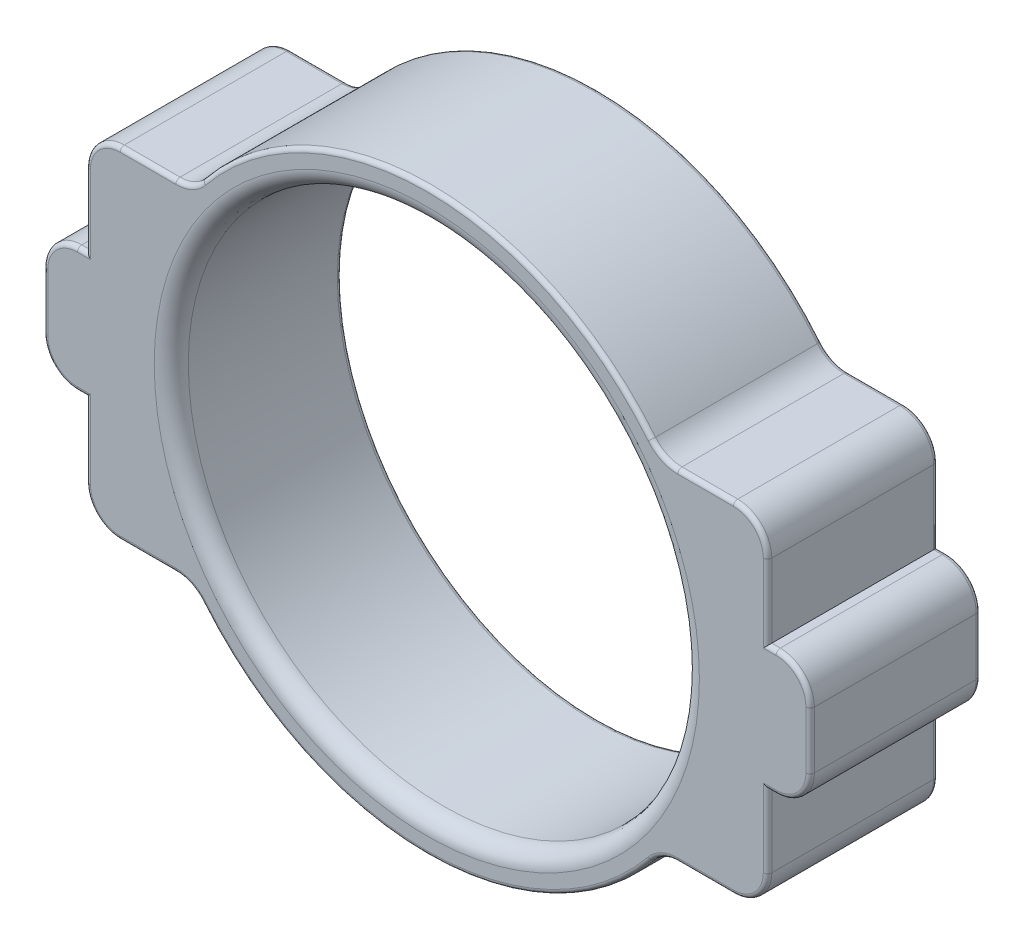
from build123d import *

# Parameters (mm, degrees)
BOSS_EXTRU_2_DEPTH           = 5
BOSS_EXTRU_2_DEPTH_BACK      = 5
ESQUISSE1_R                  = 15
ENL_V_MAT_EXTRU_1_DEPTH      = 4
ENL_V_MAT_EXTRU_1_DEPTH_BACK = 4
CONG_1_R                     = 1
CONG_2_R                     = 0.25
CONG_3_R                     = 0.25
CONG_4_R                     = 0.25


with BuildPart() as part:
    # Esquisse1 → Boss.-Extru.2 (new, two sides: drawn at the far end of the back side and taken through both)
    with BuildSketch(Plane.XY.offset(-BOSS_EXTRU_2_DEPTH_BACK)):
        with BuildLine():
            Line((14.730919863, -10), (18, -10))
            ThreePointArc((18, -10), (19.414213562, -9.414213562), (20, -8))
            Line((20, -8), (20, -3.673898915))
            Line((20, -3.673898915), (20.5, -3.673898915))
            ThreePointArc((20.5, -3.673898915), (21.914213562, -3.088112478), (22.5, -1.673898915))
            Line((22.5, -1.673898915), (22.5, 1.673898915))
            ThreePointArc((22.5, 1.673898915), (21.914213562, 3.088112478), (20.5, 3.673898915))
            Line((20.5, 3.673898915), (20, 3.673898915))
            Line((20, 3.673898915), (20, 8))
            ThreePointArc((20, 8), (19.414213562, 9.414213562), (18, 10))
            Line((18, 10), (14.730919863, 10))
            ThreePointArc((14.730919863, 10), (13.872524787, 10.193578705), (13.180296719, 10.736842105))
            ThreePointArc((13.180296719, 10.736842105), (0, 17), (-13.180296719, 10.736842105))
            ThreePointArc((-13.180296719, 10.736842105), (-13.872524787, 10.193578705), (-14.730919863, 10))
            Line((-14.730919863, 10), (-18, 10))
            ThreePointArc((-18, 10), (-19.414213562, 9.414213562), (-20, 8))
            Line((-20, 8), (-20, 3.673898915))
            Line((-20, 3.673898915), (-20.5, 3.673898915))
            ThreePointArc((-20.5, 3.673898915), (-21.914213562, 3.088112478), (-22.5, 1.673898915))
            Line((-22.5, 1.673898915), (-22.5, -1.673898915))
            ThreePointArc((-22.5, -1.673898915), (-21.914213562, -3.088112478), (-20.5, -3.673898915))
            Line((-20.5, -3.673898915), (-20, -3.673898915))
            Line((-20, -3.673898915), (-20, -8))
            ThreePointArc((-20, -8), (-19.414213562, -9.414213562), (-18, -10))
            Line((-18, -10), (-14.730919863, -10))
            ThreePointArc((-14.730919863, -10), (-13.872524787, -10.193578705), (-13.180296719, -10.736842105))
            ThreePointArc((-13.180296719, -10.736842105), (0, -17), (13.180296719, -10.736842105))
            ThreePointArc((13.180296719, -10.736842105), (13.872524787, -10.193578705), (14.730919863, -10))
        make_face()
        Circle(ESQUISSE1_R, mode=Mode.SUBTRACT)
    extrude(amount=BOSS_EXTRU_2_DEPTH + BOSS_EXTRU_2_DEPTH_BACK)

    # Esquisse2 → Enlèv. mat.-Extru.1 (cut, two sides: drawn at the far end of the back side and taken through both)
    with BuildSketch(Plane.XY.offset(-ENL_V_MAT_EXTRU_1_DEPTH_BACK)):
        with BuildLine():
            Line((-17.955181025, -8.727315148), (-16.805930325, -8.727315148))
            ThreePointArc((-16.805930325, -8.727315148), (-16.098823544, -8.434421929), (-15.805930325, -7.727315148))
            Line((-15.805930325, -7.727315148), (-15.805930325, 7.727315148))
            ThreePointArc((-15.805930325, 7.727315148), (-16.098823544, 8.434421929), (-16.805930325, 8.727315148))
            Line((-16.805930325, 8.727315148), (-17.955181025, 8.727315148))
            ThreePointArc((-17.955181025, 8.727315148), (-18.662287806, 8.434421929), (-18.955181025, 7.727315148))
            Line((-18.955181025, 7.727315148), (-18.955181025, 3.797921231))
            ThreePointArc((-18.955181025, 3.797921231), (-19.248074244, 3.09081445), (-19.955181025, 2.797921231))
            Line((-19.955181025, 2.797921231), (-20.784233073, 2.797921231))
            ThreePointArc((-20.784233073, 2.797921231), (-21.491339854, 2.505028012), (-21.784233073, 1.797921231))
            Line((-21.784233073, 1.797921231), (-21.784233073, -1.797921231))
            ThreePointArc((-21.784233073, -1.797921231), (-21.491339854, -2.505028012), (-20.784233073, -2.797921231))
            Line((-20.784233073, -2.797921231), (-19.955181025, -2.797921231))
            ThreePointArc((-19.955181025, -2.797921231), (-19.248074244, -3.09081445), (-18.955181025, -3.797921231))
            Line((-18.955181025, -3.797921231), (-18.955181025, -7.727315148))
            ThreePointArc((-18.955181025, -7.727315148), (-18.662287806, -8.434421929), (-17.955181025, -8.727315148))
        make_face()
        with BuildLine():
            Line((17.955181025, -8.727315148), (16.805930325, -8.727315148))
            ThreePointArc((16.805930325, -8.727315148), (16.098823544, -8.434421929), (15.805930325, -7.727315148))
            Line((15.805930325, -7.727315148), (15.805930325, 7.727315148))
            ThreePointArc((15.805930325, 7.727315148), (16.098823544, 8.434421929), (16.805930325, 8.727315148))
            Line((16.805930325, 8.727315148), (17.955181025, 8.727315148))
            ThreePointArc((17.955181025, 8.727315148), (18.662287806, 8.434421929), (18.955181025, 7.727315148))
            Line((18.955181025, 7.727315148), (18.955181025, 3.797921231))
            ThreePointArc((18.955181025, 3.797921231), (19.248074244, 3.09081445), (19.955181025, 2.797921231))
            Line((19.955181025, 2.797921231), (20.784233073, 2.797921231))
            ThreePointArc((20.784233073, 2.797921231), (21.491339854, 2.505028012), (21.784233073, 1.797921231))
            Line((21.784233073, 1.797921231), (21.784233073, -1.797921231))
            ThreePointArc((21.784233073, -1.797921231), (21.491339854, -2.505028012), (20.784233073, -2.797921231))
            Line((20.784233073, -2.797921231), (19.955181025, -2.797921231))
            ThreePointArc((19.955181025, -2.797921231), (19.248074244, -3.09081445), (18.955181025, -3.797921231))
            Line((18.955181025, -3.797921231), (18.955181025, -7.727315148))
            ThreePointArc((18.955181025, -7.727315148), (18.662287806, -8.434421929), (17.955181025, -8.727315148))
        make_face()
    extrude(amount=ENL_V_MAT_EXTRU_1_DEPTH + ENL_V_MAT_EXTRU_1_DEPTH_BACK, mode=Mode.SUBTRACT)

    # Congé1
    cong_1_edges = [part.edges().sort_by_distance(p)[0] for p in [
        (-15, 0, 5),
    ]]
    fillet(cong_1_edges, radius=CONG_1_R)

    # Congé2
    cong_2_edges = [part.edges().sort_by_distance(p)[0] for p in [
        (-15, 0, -5),
    ]]
    fillet(cong_2_edges, radius=CONG_2_R)

    # Congé3
    cong_3_edges = [part.edges().sort_by_distance(p)[0] for p in [
        (20, 5.836949458, -5),
        (19.414213562, 9.414213562, -5),
        (16.365459931, 10, -5),
        (13.872524787, 10.193578705, -5),
        (0, 17, -5),
        (-20, 5.836949458, -5),
        (-19.414213562, 9.414213562, -5),
        (-16.365459931, 10, -5),
        (-20, -5.836949458, -5),
        (-19.414213562, -9.414213562, -5),
        (-16.365459931, -10, -5),
        (20, -5.836949458, -5),
        (19.414213562, -9.414213562, -5),
        (16.365459931, -10, -5),
        (13.872524787, -10.193578705, -5),
        (0, -17, -5),
        (20, 5.836949458, 5),
        (19.414213562, 9.414213562, 5),
        (16.365459931, 10, 5),
        (13.872524787, 10.193578705, 5),
        (0, 17, 5),
        (-20, 5.836949458, 5),
        (-19.414213562, 9.414213562, 5),
        (-16.365459931, 10, 5),
        (-20, -5.836949458, 5),
        (-19.414213562, -9.414213562, 5),
        (-16.365459931, -10, 5),
        (20, -5.836949458, 5),
        (19.414213562, -9.414213562, 5),
        (16.365459931, -10, 5),
        (13.872524787, -10.193578705, 5),
        (0, -17, 5),
        (-13.872524787, 10.193578705, -5),
        (-13.872524787, -10.193578705, -5),
        (-13.872524787, 10.193578705, 5),
        (-13.872524787, -10.193578705, 5),
    ]]
    fillet(cong_3_edges, radius=CONG_3_R)

    # Congé4
    cong_4_edges = [part.edges().sort_by_distance(p)[0] for p in [
        (-20.125, 3.673898915, -5),
        (-20.125, -3.673898915, -5),
        (-21.914213562, -3.088112478, -5),
        (-22.5, 0, -5),
        (20.125, -3.673898915, -5),
        (21.914213562, -3.088112478, -5),
        (22.5, 0, -5),
        (20.125, 3.673898915, -5),
        (-20.125, 3.673898915, 5),
        (-20.125, -3.673898915, 5),
        (-21.914213562, -3.088112478, 5),
        (-22.5, 0, 5),
        (20.125, -3.673898915, 5),
        (21.914213562, -3.088112478, 5),
        (22.5, 0, 5),
        (20.125, 3.673898915, 5),
        (-21.914213562, 3.088112478, -5),
        (21.914213562, 3.088112478, -5),
        (-21.914213562, 3.088112478, 5),
        (21.914213562, 3.088112478, 5),
    ]]
    fillet(cong_4_edges, radius=CONG_4_R)


solid = part.part
